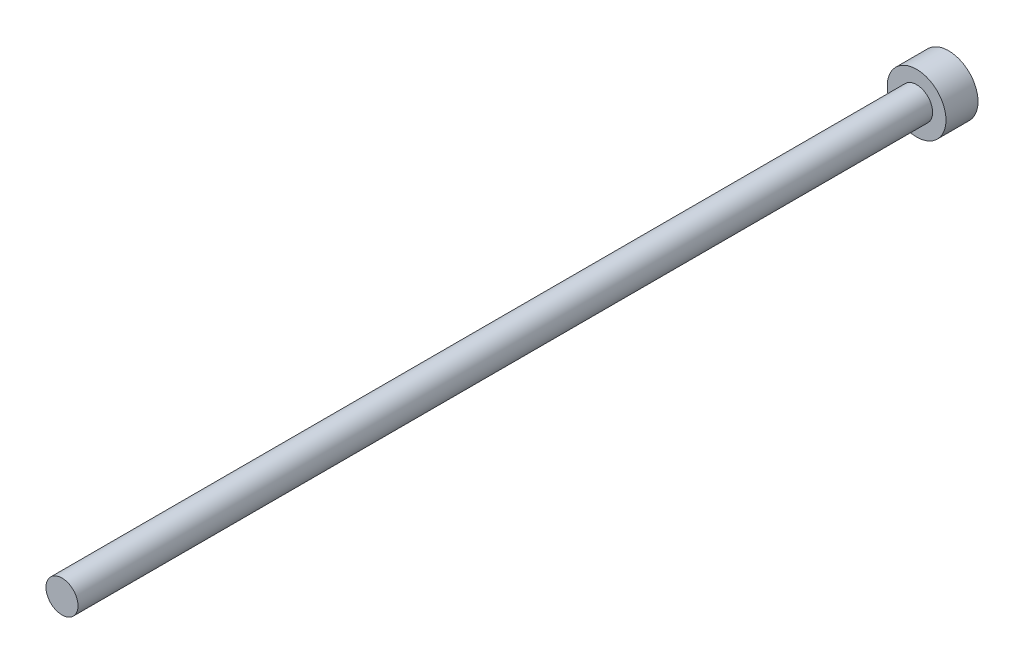
from build123d import *

# Parameters (mm, degrees)
SKETCH_1_R      = 2.75
EXTRUDE_1_DEPTH = 1.5
SKETCH_2_R      = 1.5
EXTRUDE_2_DEPTH = 80


with BuildPart() as part:
    # 草图1 → 凸台-拉伸1 (new, symmetric)
    with BuildSketch(Plane.XY):
        Circle(SKETCH_1_R)
    extrude(amount=EXTRUDE_1_DEPTH, both=True)

    # 草图2 → 凸台-拉伸2 (add)
    with BuildSketch(Plane.XY.offset(1.5)):
        Circle(SKETCH_2_R)
    extrude(amount=EXTRUDE_2_DEPTH)


solid = part.part
